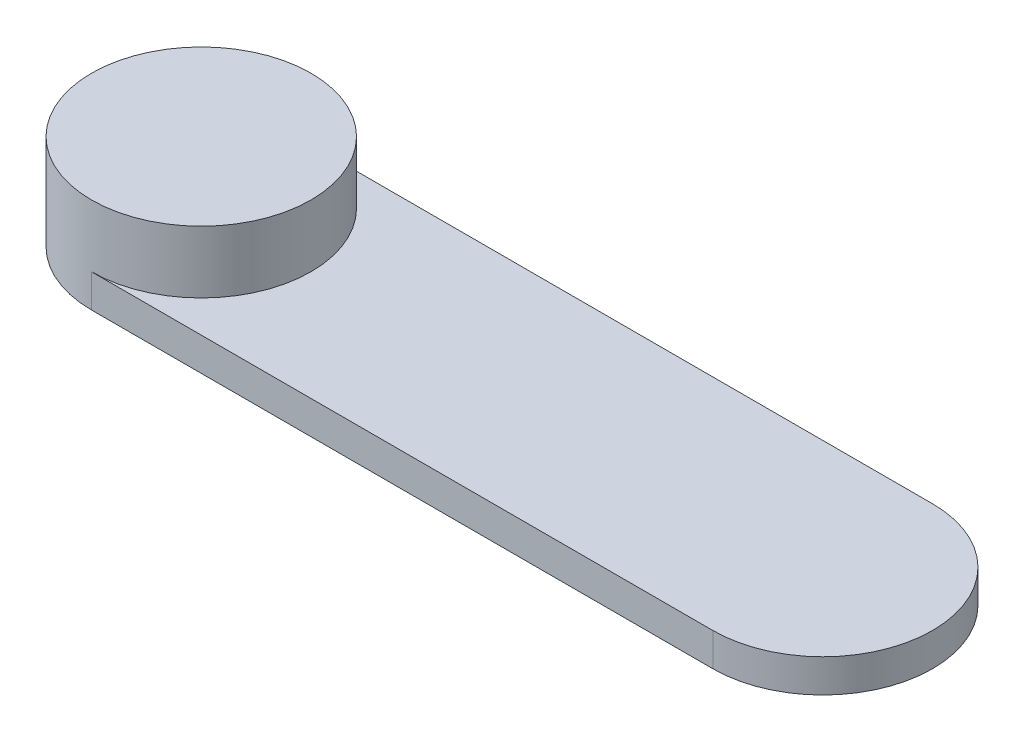
from build123d import *

# Parameters (mm, degrees)
EXTRUDE_1_DEPTH = 8
SKETCH_2_R      = 26.5
EXTRUDE_2_DEPTH = 15


with BuildPart() as part:
    # 草图1 → 凸台-拉伸1 (new body)
    with BuildSketch(Plane(origin=(0, 0, 0), x_dir=(1, 0, 0), z_dir=(0, 1, 0))):
        with BuildLine():
            Line((75, -26.5), (-75, -26.5))
            ThreePointArc((-75, -26.5), (-101.5, 0), (-75, 26.5))
            Line((-75, 26.5), (75, 26.5))
            ThreePointArc((75, 26.5), (101.5, 0), (75, -26.5))
        make_face()
    extrude(amount=EXTRUDE_1_DEPTH)

    # 草图2 → 凸台-拉伸2 (add)
    with BuildSketch(Plane(origin=(0, 8, 0), x_dir=(1, 0, 0), z_dir=(0, 1, 0))):
        with Locations(Location((-75, 0, 0), (0, 0, 270))):
            Circle(SKETCH_2_R)
    extrude(amount=EXTRUDE_2_DEPTH)


solid = part.part
